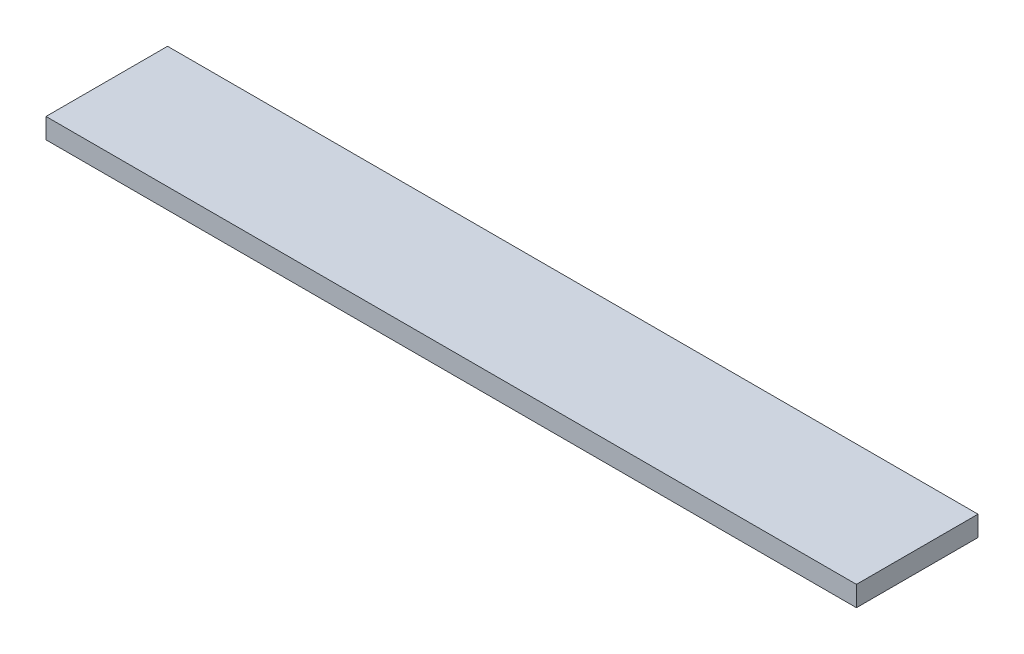
from build123d import *

# Parameters (mm, degrees)
SKETCH1_W           = 80
SKETCH1_H           = 12
BOSS_EXTRUDE1_DEPTH = 2


with BuildPart() as part:
    # Sketch1 → Boss-Extrude1 (new body)
    with BuildSketch(Plane(origin=(0, 0, 0), x_dir=(1, 0, 0), z_dir=(0, 1, 0))):
        Rectangle(SKETCH1_W, SKETCH1_H)
    extrude(amount=BOSS_EXTRUDE1_DEPTH)


solid = part.part
